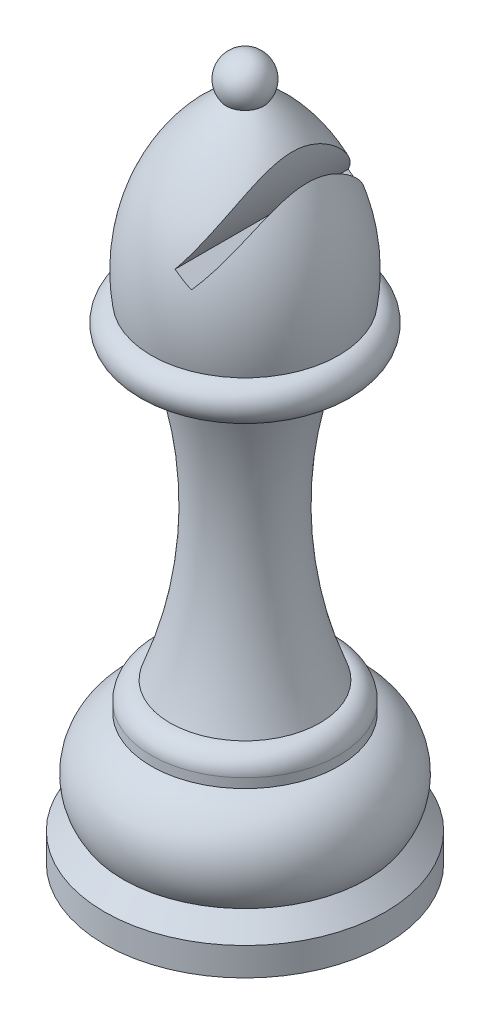
from build123d import *

# Parameters (mm, degrees)
KES_EKSTR_ZYON1_DEPTH      = 76.5493223
KES_EKSTR_ZYON1_DEPTH_BACK = 76.5493223


with BuildPart() as part:
    # Çizim1 → Döndür4 (revolve)
    with BuildSketch(Plane.XY, mode=Mode.PRIVATE) as d_nd_r4_sk:
        with BuildLine():
            Line((-15, -72.51), (0, -72.51))
            Line((0, -72.51), (0, 2.5))
            ThreePointArc((0, 2.5), (-2.236067977, 1.118033989), (-2, -1.5))
            ThreePointArc((-2, -1.5), (-8.653286276, -9.916343641), (-10, -20.56))
            ThreePointArc((-10, -20.56), (-11.71786528, -22.54), (-10, -24.52))
            Line((-10, -24.52), (-7.5, -24.52))
            ThreePointArc((-7.5, -24.52), (-4.992249752, -40.074451165), (-8, -55.54))
            ThreePointArc((-8, -55.54), (-9.414213562, -56.125786438), (-10, -57.54))
            Line((-10, -57.54), (-10, -58.54))
            ThreePointArc((-10, -58.54), (-13.688325627, -62.293118519), (-13, -67.51))
            Line((-13, -67.51), (-15, -69.51))
            Line((-15, -69.51), (-15, -72.51))
        make_face()
    revolve(d_nd_r4_sk.sketch.rotate(Axis((0, 9.942203098, 0), (0, -1, 0)), 270), axis=Axis((0, 9.942203098, 0), (0, -1, 0)))

    # Çizim2 → Kes-Ekstrüzyon1 (cut, two sides: drawn at the far end of the back side and taken through both)
    with BuildSketch(Plane.XY.offset(-KES_EKSTR_ZYON1_DEPTH_BACK)):
        with BuildLine():
            Line((1.7767843, -12.070571406), (3.393042446, -13.248583842))
            ThreePointArc((3.393042446, -13.248583842), (5.4656679, -9.965335521), (6.652988107, -6.268611764))
            ThreePointArc((6.652988107, -6.268611764), (5.873557548, -5.218434009), (5.027158096, -4.221441894))
            ThreePointArc((5.027158096, -4.221441894), (3.871676467, -8.34051455), (1.7767843, -12.070571406))
        make_face()
    extrude(amount=KES_EKSTR_ZYON1_DEPTH + KES_EKSTR_ZYON1_DEPTH_BACK, mode=Mode.SUBTRACT)


solid = part.part
